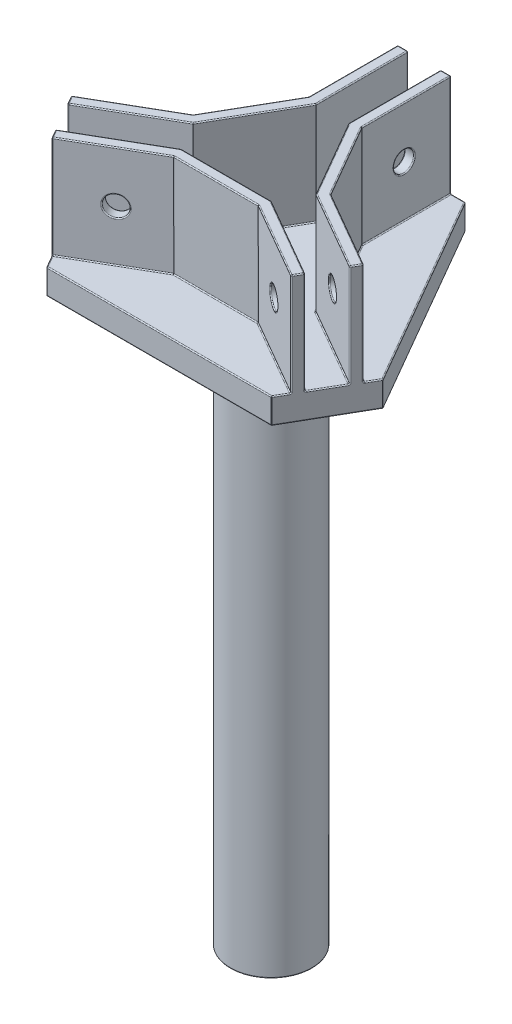
from build123d import *

# Parameters (mm, degrees)
BOSS_EXTRUDE1_DEPTH = 2.5
BOSS_EXTRUDE2_DEPTH = 10
SKETCH3_R           = 4
BOSS_EXTRUDE3_DEPTH = 55
SKETCH5_R           = 1.0000000000000013
CUT_EXTRUDE1_DEPTH  = 63.20886860676163
CIRPATTERN1_COUNT   = 3
FILLET1_R           = 0.1


with BuildPart() as part:
    # Sketch1 → Boss-Extrude1 (new body)
    with BuildSketch(Plane(origin=(0, 0, 0), x_dir=(1, 0, 0), z_dir=(0, 1, 0))):
        Polygon((-4, 15.011106998930288), (4, 15.011106998930288), (14.999999999999991, -4.041451884327456), (10.99999999999996, -10.969655114602947), (-11.000000000000037, -10.969655114602869), (-15.00000000000002, -4.04145188432735), align=None)
    extrude(amount=-BOSS_EXTRUDE1_DEPTH)

    # Sketch2 → Boss-Extrude2 (add)
    with BuildSketch(Plane(origin=(0, 0, 0), x_dir=(1, 0, 0), z_dir=(0, 1, 0))):
        Polygon((-12.200000000000031, -8.891194145520213), (-4.405771365940075, -4.391194145520232), (4.405771365940075, -4.391194145520232), (12.200000000000003, -8.891194145520268), (11.7, -9.757219549304706), (4.13782217350895, -5.391194145520232), (-4.137822173508954, -5.391194145520232), (-11.700000000000033, -9.75721954930465), align=None)
        Polygon((-1.5999999999998948, 15.011106998930297), (-2.599999999999893, 15.011106998930304), (-2.5999999999999557, 6.279056191361426), (-6.737822173508942, -0.8878620458411444), (-14.300000000000052, -5.253887449625513), (-13.80000000000006, -6.119912853409956), (-6.005771365940068, -1.6199128534100269), (-1.599999999999957, 6.011106998930297), align=None)
        Polygon((13.79999999999994, -6.1199128534102), (14.299999999999944, -5.253887449625768), (6.73782217350893, -0.8878620458412415), (2.600000000000045, 6.279056191361384), (2.6000000000001666, 15.011106998930257), (1.6000000000001655, 15.011106998930272), (1.6000000000000414, 6.011106998930273), (6.005771365940046, -1.619912853410111), align=None)
    extrude(amount=BOSS_EXTRUDE2_DEPTH)

    # Sketch3 → Boss-Extrude3 (add)
    with BuildSketch(Plane.XZ.offset(2.5)):
        with Locations(Location((0, 0, 0), (0, 0, 270))):
            Circle(SKETCH3_R)
    extrude(amount=BOSS_EXTRUDE3_DEPTH)

    # Sketch5 → Cut-Extrude1 (cut, through all)
    with BuildSketch(Plane(origin=(-1.2999999999999898, 0, 2.2516660498394985), x_dir=(0.8660254037844363, 0, 0.5000000000000043), z_dir=(-0.5000000000000042, 0, 0.8660254037844362))):
        with Locations((10.427006116174198, 5)):
            Circle(SKETCH5_R)
    cut_extrude1 = extrude(amount=-CUT_EXTRUDE1_DEPTH, mode=Mode.SUBTRACT)

    # CirPattern1: Cut-Extrude1 ×3 about axis
    cirpattern1_axis = Axis((0, -57.5, 0), (0, 1, 0))
    for i in range(1, CIRPATTERN1_COUNT):
        add(cut_extrude1.rotate(cirpattern1_axis, i * 360 / CIRPATTERN1_COUNT), mode=Mode.SUBTRACT)

    # Fillet1
    fillet1_edges = [part.edges().sort_by_distance(p)[0] for p in [
        (-7.36402677823815, 5, 6.099143704142189),
        (-6.864026778238156, 5, 6.965169107926628),
        (-8.964026778238148, 5, 3.327862412031951),
        (-9.464026778238125, 5, 2.4618370082475423),
        (-4, -1.25, -15.011106998930288),
        (4, -1.25, -15.011106998930288),
        (14.999999999999991, -1.25, 4.041451884327456),
        (-2.5999999999999313, 5, -9.42700611617421),
        (-1.599999999999932, 5, -9.427006116174205),
        (1.6000000000000973, 5, -9.427006116174189),
        (2.600000000000007, 5, -9.427006116174184),
        (10.99999999999996, -1.25, 10.969655114602947),
        (-11.000000000000037, -1.25, 10.969655114602869),
        (-15.00000000000002, -1.25, 4.04145188432735),
        (-3.908e-14, -2.5, 10.969655114602908),
        (12.999999999999975, -2.5, 7.505553499465202),
        (-11.350000000000037, 0, 10.36343733195376),
        (12.999999999999961, 0, 7.505553499465227),
        (9.499999999999996, -2.5, -5.484827557301415),
        (-12.200000000000031, 5, 8.891194145520213),
        (-7.918911086754493, 0, 7.574206847412441),
        (-11.700000000000033, 5, 9.75721954930465),
        (-1.78e-15, 0, 5.391194145520232),
        (-4.137822173508954, 5, 5.391194145520232),
        (7.918911086754475, 0, 7.574206847412469),
        (4.13782217350895, 5, 5.391194145520232),
        (0, -2.5, -15.011106998930288),
        (11.7, 5, 9.757219549304706),
        (8.30288568297004, 0, 6.64119414552025),
        (12.200000000000003, 5, 8.891194145520268),
        (0, 0, 4.391194145520232),
        (4.405771365940075, 5, 4.391194145520232),
        (-8.302885682970054, 0, 6.641194145520222),
        (-4.405771365940075, 5, 4.391194145520232),
        (-11.950000000000031, 10, 9.324206847412432),
        (-7.918911086754493, 10, 7.574206847412441),
        (-1.78e-15, 10, 5.391194145520232),
        (7.918911086754475, 10, 7.574206847412469),
        (11.950000000000001, 10, 9.324206847412487),
        (8.30288568297004, 10, 6.64119414552025),
        (0, 10, 4.391194145520232),
        (-8.302885682970054, 10, 6.641194145520222),
        (-13.000000000000043, 0, 7.505553499465083),
        (-3.2999999999999465, 0, -15.011106998930288),
        (-1.599999999999926, 0, -10.511106998930298),
        (-1.599999999999957, 5, -6.011106998930297),
        (-1.5999999999998948, 5, -15.011106998930297),
        (-2.599999999999924, 0, -10.645081595145864),
        (-2.599999999999893, 5, -15.011106998930304),
        (-4.6689110867544485, 0, -2.695597072760141),
        (-2.5999999999999557, 5, -6.279056191361426),
        (-10.518911086754496, 0, 3.0708747477333285),
        (-6.737822173508942, 5, 0.8878620458411444),
        (-14.300000000000052, 5, 5.253887449625513),
        (-9.902885682970064, 0, 3.869912853409992),
        (-13.80000000000006, 5, 6.119912853409956),
        (-3.8028856829700124, 0, -2.1955970727601355),
        (-6.005771365940068, 5, 1.6199128534100269),
        (-1.599999999999926, 10, -10.511106998930298),
        (-2.099999999999894, 10, -15.0111069989303),
        (-2.599999999999924, 10, -10.645081595145864),
        (-4.6689110867544485, 10, -2.695597072760141),
        (-10.518911086754496, 10, 3.0708747477333285),
        (-14.050000000000056, 10, 5.686900151517735),
        (-9.902885682970064, 10, 3.869912853409992),
        (-3.8028856829700124, 10, -2.1955970727601355),
        (-9.50000000000001, -2.5, -5.484827557301469),
        (14.649999999999961, 0, 4.647669666976609),
        (1.35e-13, 0, -15.011106998930288),
        (9.902885682969993, 0, 3.8699128534101552),
        (6.005771365940046, 5, 1.619912853410111),
        (13.79999999999994, 5, 6.1199128534102),
        (10.518911086754438, 0, 3.0708747477335048),
        (14.299999999999944, 5, 5.253887449625768),
        (4.668911086754488, 0, -2.695597072760071),
        (6.73782217350893, 5, 0.8878620458412415),
        (2.600000000000106, 0, -10.645081595145822),
        (2.600000000000045, 5, -6.279056191361384),
        (2.6000000000001666, 5, -15.011106998930257),
        (1.6000000000001036, 0, -10.511106998930272),
        (1.6000000000001655, 5, -15.011106998930272),
        (3.8028856829700435, 0, -2.195597072760081),
        (1.6000000000000414, 5, -6.011106998930273),
        (9.902885682969993, 10, 3.8699128534101552),
        (3.3000000000000833, 0, -15.011106998930288),
        (14.049999999999942, 10, 5.686900151517984),
        (10.518911086754438, 10, 3.0708747477335048),
        (4.668911086754488, 10, -2.695597072760071),
        (2.600000000000106, 10, -10.645081595145822),
        (2.100000000000166, 10, -15.011106998930265),
        (1.6000000000001036, 10, -10.511106998930272),
        (3.8028856829700435, 10, -2.195597072760081),
        (9.499999999999996, 0, -5.484827557301415),
        (11.349999999999973, 0, 10.363437331953822),
        (-3.908e-14, 0, 10.969655114602908),
        (-14.650000000000036, 0, 4.647669666976431),
        (-9.50000000000001, 0, -5.484827557301469),
        (-13.000000000000028, -2.5, 7.50555349946511),
        (1.22e-15, -2.5, 4),
        (1.22e-15, -57.5, 4),
        (7.3640267782381255, 5, 6.099143704142196),
        (9.464026778238084, 5, 2.461837008247668),
        (8.96402677823808, 5, 3.3278624120321028),
        (6.864026778238118, 5, 6.965169107926638),
    ]]
    fillet(fillet1_edges, radius=FILLET1_R)


solid = part.part
